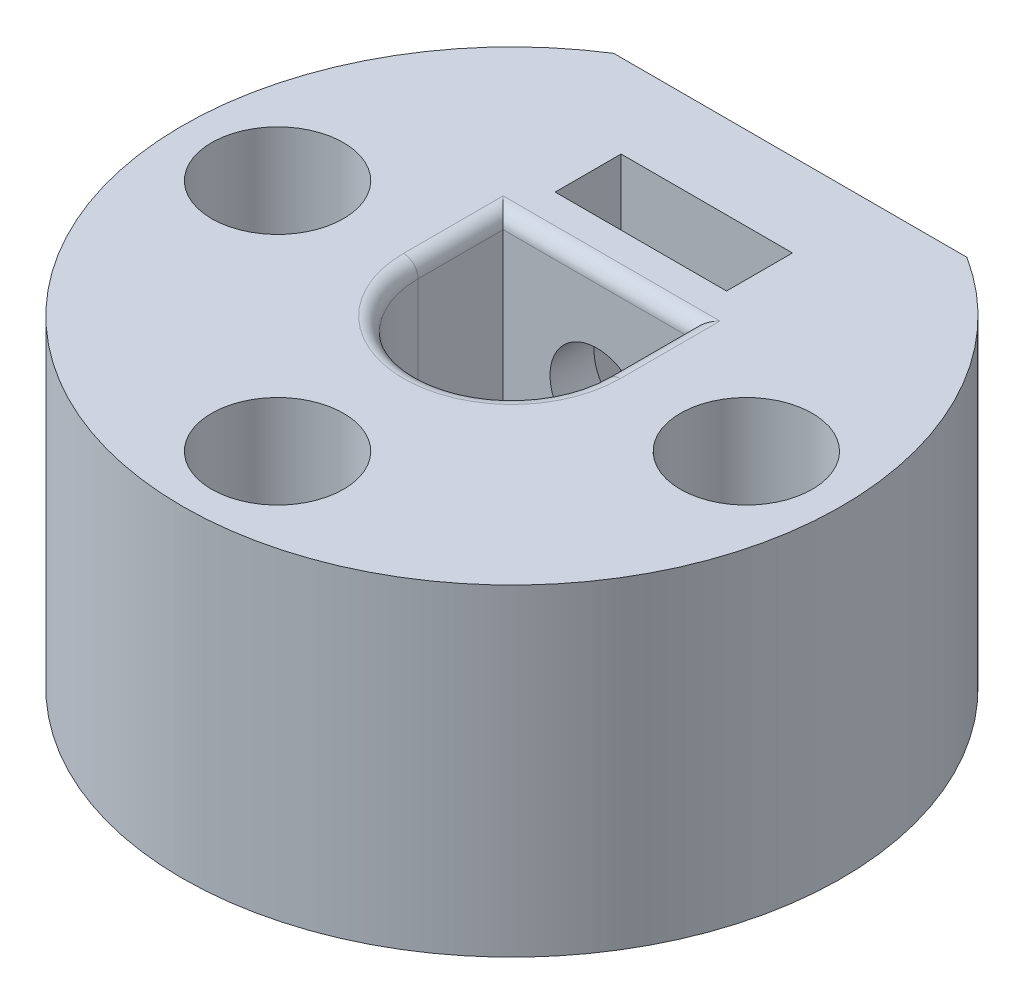
from build123d import *

# Parameters (mm, degrees)
BOSS_EXTRU_1_DEPTH                              = 8
CONG_1_R                                        = 0.5
ESQUISSE6_R                                     = 1.6
ENL_V_MAT_EXTRU_1_DEPTH                         = 18.808003863
ESQUISSE7_W                                     = 5.85
ESQUISSE7_H                                     = 2.25
ENL_V_MAT_EXTRU_2_DEPTH                         = 18.808003863
BOSS_EXTRU_2_START                              = 3
BOSS_EXTRU_2_DEPTH                              = 3
CHAMBRAGE_POUR_VIS_T_TE_CYLINDRIQUE_D           = 2.5
CHAMBRAGE_POUR_VIS_T_TE_CYLINDRIQUE_CBORE_D     = 4.5
CHAMBRAGE_POUR_VIS_T_TE_CYLINDRIQUE_CBORE_DEPTH = 5.3
ESQUISSE14_R                                    = 4.25
ENL_V_MAT_EXTRU_3_DEPTH                         = 2


with BuildPart() as part:
    # Esquisse1 → Boss.-Extru.1 (new body)
    with BuildSketch(Plane(origin=(0, 0, 0), x_dir=(1, 0, 0), z_dir=(0, 1, 0))):
        with BuildLine():
            Line((6.025985397, 9.5), (-6.025985397, 9.5))
            ThreePointArc((-6.025985397, 9.5), (0, -11.25), (6.025985397, 9.5))
        make_face()
        with BuildLine():
            Line((-3.2, 0), (-3.2, 2.9))
            Line((-3.2, 2.9), (3.2, 2.9))
            Line((3.2, 2.9), (3.2, 0))
            ThreePointArc((3.2, 0), (0, -3.2), (-3.2, 0))
        make_face(mode=Mode.SUBTRACT)
    extrude(amount=BOSS_EXTRU_1_DEPTH)

    # Congé1
    cong_1_edges = [part.edges().sort_by_distance(p)[0] for p in [
        (0, 8, 3.2),
        (3.2, 8, -1.45),
        (0, 8, -2.9),
        (-3.2, 8, -1.45),
    ]]
    fillet(cong_1_edges, radius=CONG_1_R)

    # Esquisse6 → Enlèv. mat.-Extru.1 (cut, through all)
    with BuildSketch(Plane.XY):
        with Locations((0, 4)):
            Circle(ESQUISSE6_R)
    extrude(amount=-ENL_V_MAT_EXTRU_1_DEPTH, mode=Mode.SUBTRACT)

    # Esquisse7 → Enlèv. mat.-Extru.2 (cut, through all)
    with BuildSketch(Plane(origin=(0, 0, 0), x_dir=(1, 0, 0), z_dir=(0, 1, 0))):
        with Locations((0, 5.525)):
            Rectangle(ESQUISSE7_W, ESQUISSE7_H)
    extrude(amount=ENL_V_MAT_EXTRU_2_DEPTH, mode=Mode.SUBTRACT)

    # Esquisse8 → Boss.-Extru.2 (add)
    with BuildSketch(Plane.XZ.offset(BOSS_EXTRU_2_START)):
        with BuildLine():
            Line((-6.025985397, -9.5), (6.025985397, -9.5))
            ThreePointArc((6.025985397, -9.5), (0, 11.25), (-6.025985397, -9.5))
        make_face()
    extrude(amount=-BOSS_EXTRU_2_DEPTH)

    # Chambrage pour vis à tête cylindrique à 6 pans creux (ou vis CHC) M21 (through all)
    with Locations(Plane(origin=(0, 8, 0), x_dir=(1, 0, 0), z_dir=(0, 1, 0))):
        with Locations((-8, 0), (0, -8), (8, 0)):
            CounterBoreHole(CHAMBRAGE_POUR_VIS_T_TE_CYLINDRIQUE_D / 2, CHAMBRAGE_POUR_VIS_T_TE_CYLINDRIQUE_CBORE_D / 2, CHAMBRAGE_POUR_VIS_T_TE_CYLINDRIQUE_CBORE_DEPTH)

    # Esquisse14 → Enlèv. mat.-Extru.3 (cut)
    with BuildSketch(Plane.XZ.offset(3)):
        with Locations(Location((0, 0, 0), (0, 0, 270))):
            Circle(ESQUISSE14_R)
    extrude(amount=-ENL_V_MAT_EXTRU_3_DEPTH, mode=Mode.SUBTRACT)


solid = part.part
